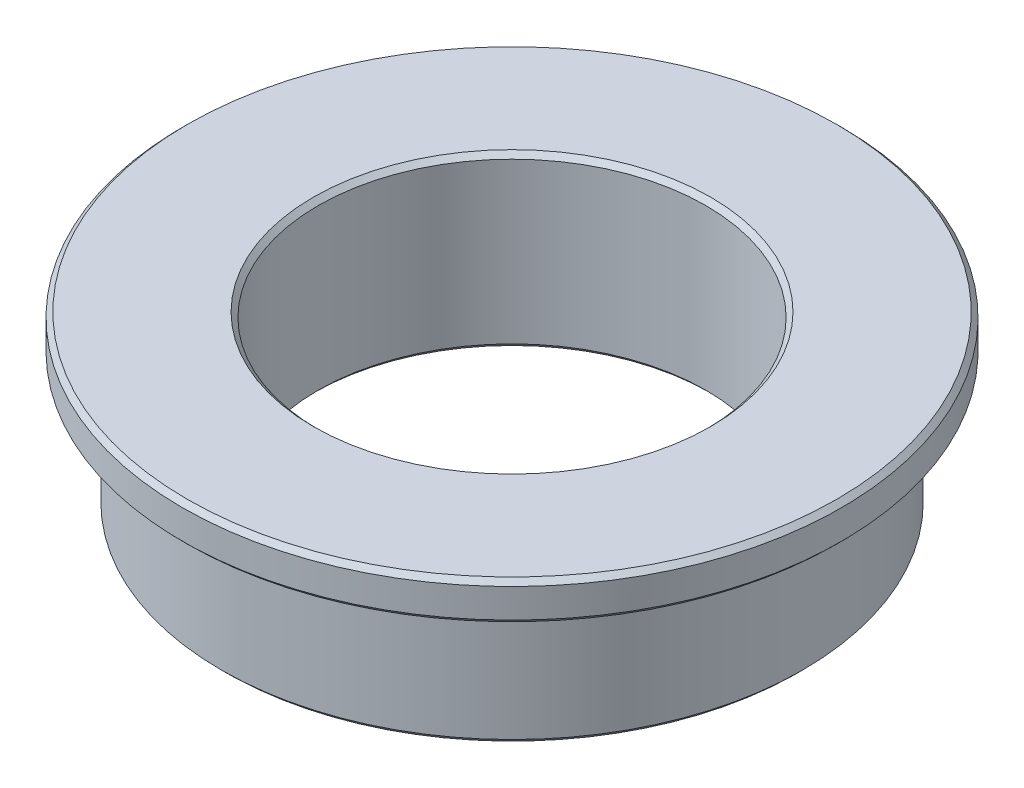
from build123d import *

# Parameters (mm, degrees)
CHAMFER_1_SIZE = 0.1


with BuildPart() as part:
    # 草图1 → 旋转1 (revolve)
    with BuildSketch(Plane.XY, mode=Mode.PRIVATE) as revolve_1_sk:
        Polygon((6, 0), (6, 2.7), (6.8, 2.7), (6.8, 3.5), (4, 3.5), (4, 0), align=None)
    revolve(revolve_1_sk.sketch.rotate(Axis((0, 0, 0), (0, 1, 0)), 90), axis=Axis((0, 0, 0), (0, 1, 0)))

    # 倒角1
    chamfer_1_edges = [part.edges().sort_by_distance(p)[0] for p in [
        (0, 0, 4),
        (0, 3.5, 4),
        (0, 3.5, 6.8),
        (0, 2.7, 6.8),
        (0, 0, 6),
    ]]
    chamfer(chamfer_1_edges, length=CHAMFER_1_SIZE)


solid = part.part
